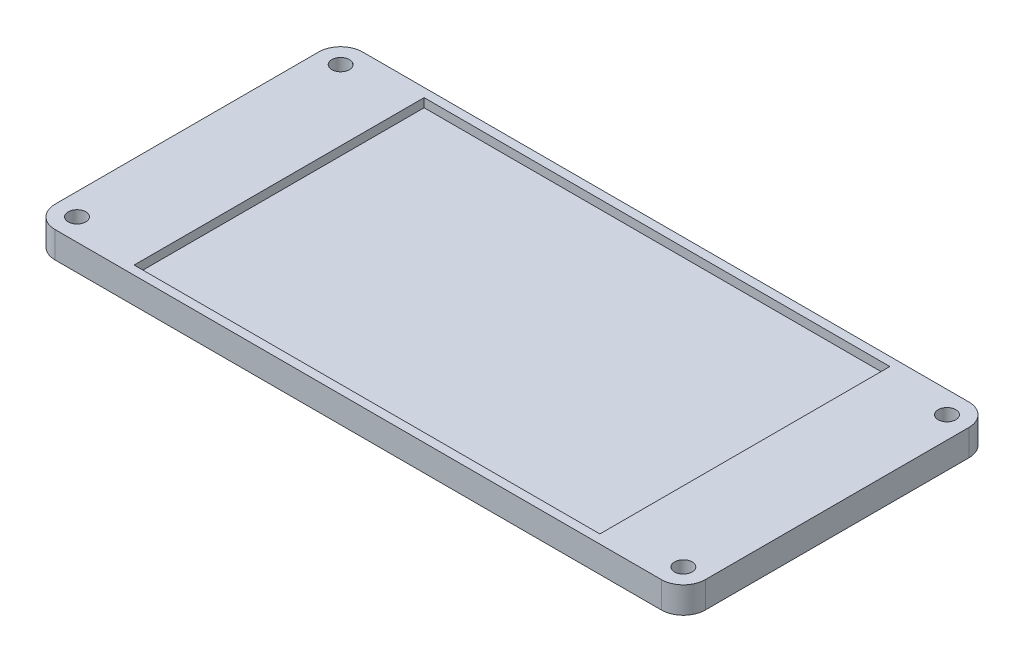
from build123d import *

# Parameters (mm, degrees)
SZKIC1_W                    = 74
SZKIC1_H                    = 35
DODANIE_WYCI_GNI_CIE1_DEPTH = 3
SZKIC2_W                    = 53
SZKIC2_H                    = 33
WYTNIJ_WYCI_GNI_CIE1_DEPTH  = 1
SZKIC4_R                    = 1
WYTNIJ_WYCI_GNI_CIE2_DEPTH  = 42.039615008
ZAOKR_GLENIE1_R             = 2.5
LUSTRO2_COPY_1_SKETCH_R     = 1
LUSTRO2_COPY_1_DEPTH        = 42.039615008


with BuildPart() as part:
    # Szkic1 → Dodanie-wyciągnięcie1 (new body)
    with BuildSketch(Plane(origin=(0, 0, 0), x_dir=(1, 0, 0), z_dir=(0, 1, 0))):
        Rectangle(SZKIC1_W, SZKIC1_H)
    extrude(amount=DODANIE_WYCI_GNI_CIE1_DEPTH)

    # Szkic2 → Wytnij-wyciągnięcie1 (cut)
    with BuildSketch(Plane(origin=(0, 3, 0), x_dir=(1, 0, 0), z_dir=(0, 1, 0))):
        Rectangle(SZKIC2_W, SZKIC2_H)
    extrude(amount=-WYTNIJ_WYCI_GNI_CIE1_DEPTH, mode=Mode.SUBTRACT)

    # Szkic4 → Wytnij-wyciągnięcie2 (cut, through all)
    with BuildSketch(Plane(origin=(0, 3, 0), x_dir=(1, 0, 0), z_dir=(0, 1, 0))):
        with Locations(Location((-34.5, 15, 0), (0, 0, 270))):
            Circle(SZKIC4_R)
    wytnij_wyci_gni_cie2 = extrude(amount=-WYTNIJ_WYCI_GNI_CIE2_DEPTH, mode=Mode.SUBTRACT)

    # Zaokrąglenie1
    zaokr_glenie1_edges = [part.edges().sort_by_distance(p)[0] for p in [
        (37, 1.5, 17.5),
        (-37, 1.5, 17.5),
        (-37, 1.5, -17.5),
        (37, 1.5, -17.5),
    ]]
    fillet(zaokr_glenie1_edges, radius=ZAOKR_GLENIE1_R)

    # Lustro1: Wytnij-wyciągnięcie2 across plane
    add(wytnij_wyci_gni_cie2.mirror(Plane.XY), mode=Mode.SUBTRACT)

    # Lustro2: Wytnij-wyciągnięcie2 across plane
    add(wytnij_wyci_gni_cie2.mirror(Plane(origin=(0, 0, 0), x_dir=(0, 0, 1), z_dir=(1, 0, 0))), mode=Mode.SUBTRACT)

    # Lustro2 copy 1 sketch → Lustro2 copy 1 (cut, through all)
    with BuildSketch(Plane(origin=(0, 3, 0), x_dir=(-1, 0, 0), z_dir=(0, 1, 0))):
        with Locations(Location((-34.5, 15, 0), (0, 0, 270))):
            Circle(LUSTRO2_COPY_1_SKETCH_R)
    extrude(amount=-LUSTRO2_COPY_1_DEPTH, mode=Mode.SUBTRACT)


solid = part.part
